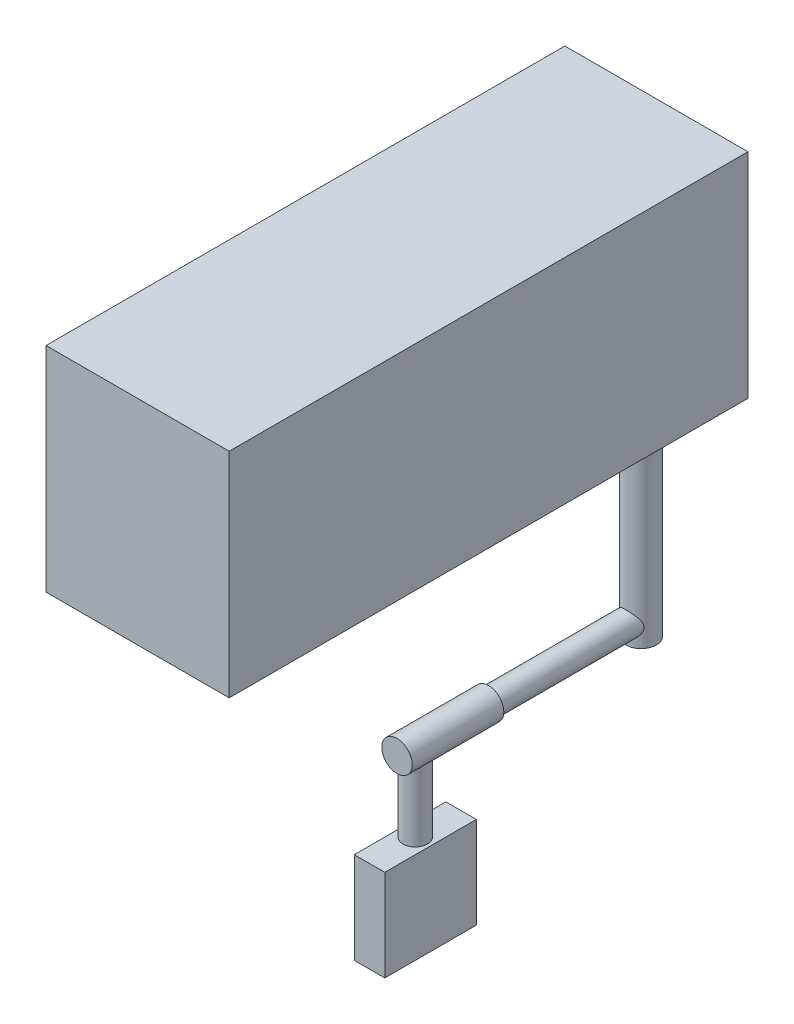
from build123d import *

# Parameters (mm, degrees)
CROQUIS5_R                   = 5
SALIENTE_EXTRUIR2_DEPTH      = 70
CROQUIS6_R                   = 4
SALIENTE_EXTRUIR3_DEPTH      = 50
CROQUIS7_R                   = 5
SALIENTE_EXTRUIR4_DEPTH      = 30
SALIENTE_EXTRUIR5_DEPTH      = 5
SALIENTE_EXTRUIR5_DEPTH_BACK = 20
CROQUIS8_R                   = 4
CROQUIS10_W                  = 10
CROQUIS10_H                  = 30
SALIENTE_EXTRUIR6_DEPTH      = 30
CROQUIS11_W                  = 60
CROQUIS11_H                  = 170
SALIENTE_EXTRUIR7_DEPTH      = 70


with BuildPart() as part:
    # Croquis5 → Saliente-Extruir2 (new body)
    with BuildSketch(Plane(origin=(0, 0, 0), x_dir=(1, 0, 0), z_dir=(0, 1, 0))):
        with Locations(Location((0, 0, 0), (0, 0, 270))):
            Circle(CROQUIS5_R)
    extrude(amount=SALIENTE_EXTRUIR2_DEPTH)

    # Croquis6 → Saliente-Extruir3 (add)
    with BuildSketch(Plane.XY):
        with Locations(Location((0, 6, 0), (0, 0, 180))):
            Circle(CROQUIS6_R)
    extrude(amount=SALIENTE_EXTRUIR3_DEPTH)

    # Croquis7 → Saliente-Extruir4 (add)
    with BuildSketch(Plane.XY.offset(50)):
        with Locations((0, 6)):
            Circle(CROQUIS7_R)
    extrude(amount=SALIENTE_EXTRUIR4_DEPTH)

    # Croquis8 → Saliente-Extruir5 (add, two sides: drawn at the far end of the back side and taken through both)
    with BuildSketch(Plane(origin=(0, 0, 0), x_dir=(1, 0, 0), z_dir=(0, 1, 0)).offset(-SALIENTE_EXTRUIR5_DEPTH_BACK)):
        with Locations(Location((0, -74, 0), (0, 0, 90))):
            Circle(CROQUIS8_R)
    extrude(amount=SALIENTE_EXTRUIR5_DEPTH + SALIENTE_EXTRUIR5_DEPTH_BACK)

    # Croquis10 → Saliente-Extruir6 (add)
    with BuildSketch(Plane.XZ.offset(20)):
        with Locations((0, 74)):
            Rectangle(CROQUIS10_W, CROQUIS10_H)
    extrude(amount=SALIENTE_EXTRUIR6_DEPTH)

    # Croquis11 → Saliente-Extruir7 (add)
    with BuildSketch(Plane(origin=(0, 70, 0), x_dir=(1, 0, 0), z_dir=(0, 1, 0))):
        with Locations((-10, -70)):
            Rectangle(CROQUIS11_W, CROQUIS11_H)
    extrude(amount=SALIENTE_EXTRUIR7_DEPTH)


solid = part.part
